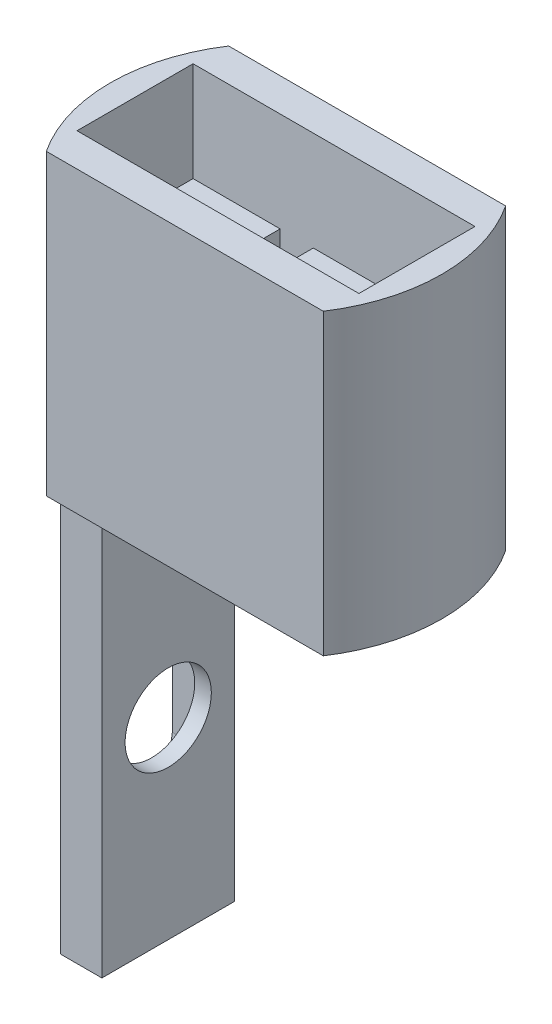
from build123d import *

# Parameters (mm, degrees)
SKETCH3_R           = 10
BOSS_EXTRUDE1_DEPTH = 18
SKETCH4_W           = 2.5
SKETCH4_H           = 8
BOSS_EXTRUDE2_DEPTH = 25
CUT_EXTRUDE1_REACH  = 33.579
SKETCH5_R           = 2.6
SKETCH7_W           = 17
SKETCH7_H           = 7
CUT_EXTRUDE3_DEPTH  = 6
SKETCH8_W           = 2
SKETCH8_H           = 7
CUT_EXTRUDE4_DEPTH  = 4
SKETCH11_W          = 5.5
SKETCH11_H          = 21
CUT_EXTRUDE7_DEPTH  = 1.5
CUT_EXTRUDE5_DEPTH  = 43
BOSS_EXTRUDE3_DEPTH = 1.5


with BuildPart() as part:
    # Sketch3 → Boss-Extrude1 (new body)
    with BuildSketch(Plane(origin=(0, 0, 0), x_dir=(1, 0, 0), z_dir=(0, 1, 0))):
        with Locations(Location((0, 0, 0), (0, 0, 270))):
            Circle(SKETCH3_R)
    extrude(amount=BOSS_EXTRUDE1_DEPTH)

    # Sketch4 → Boss-Extrude2 (add)
    with BuildSketch(Plane(origin=(0, 0, 0), x_dir=(-1, 0, 0), z_dir=(0, -1, 0))):
        with Locations((7.75, 0)):
            Rectangle(SKETCH4_W, SKETCH4_H)
    extrude(amount=BOSS_EXTRUDE2_DEPTH)

    # Sketch5 → Cut-Extrude1 (cut, up to next)
    with BuildSketch(Plane(origin=(-6.5, 0, 0), x_dir=(0, 0, -1), z_dir=(1, 0, 0)), mode=Mode.PRIVATE) as cut_extrude1_sk1:
        with Locations((0, -13.4)):
            Circle(SKETCH5_R)
    cut_extrude1_tool1 = extrude(cut_extrude1_sk1.sketch, amount=-CUT_EXTRUDE1_REACH, mode=Mode.PRIVATE) & part.part
    add(cut_extrude1_tool1.solids().sort_by_distance((-6.5, -13.4, 0))[0], mode=Mode.SUBTRACT)

    # Sketch7 → Cut-Extrude3 (cut)
    with BuildSketch(Plane(origin=(0, 18, 0), x_dir=(1, 0, 0), z_dir=(0, 1, 0))):
        Rectangle(SKETCH7_W, SKETCH7_H)
    extrude(amount=-CUT_EXTRUDE3_DEPTH, mode=Mode.SUBTRACT)

    # Sketch8 → Cut-Extrude4 (cut)
    with BuildSketch(Plane(origin=(0, 12, 0), x_dir=(1, 0, 0), z_dir=(0, 1, 0))):
        with Locations((-2.25, 0)):
            Rectangle(SKETCH8_W, SKETCH8_H)
    extrude(amount=-CUT_EXTRUDE4_DEPTH, mode=Mode.SUBTRACT)

    # Sketch11 → Cut-Extrude7 (cut)
    with BuildSketch(Plane.ZY.offset(9)):
        with Locations((0, -13.4)):
            Rectangle(SKETCH11_W, SKETCH11_H)
    extrude(amount=-CUT_EXTRUDE7_DEPTH, mode=Mode.SUBTRACT)

    # Sketch9 → Cut-Extrude5 (cut)
    with BuildSketch(Plane.XZ):
        with BuildLine():
            Line((8.351646544, -5.5), (-8.351646544, -5.5))
            ThreePointArc((-8.351646544, -5.5), (0, -10), (8.351646544, -5.5))
        make_face()
        with BuildLine():
            Line((8.351646544, 5.5), (-8.351646544, 5.5))
            ThreePointArc((-8.351646544, 5.5), (0, 10), (8.351646544, 5.5))
        make_face()
    extrude(amount=-CUT_EXTRUDE5_DEPTH, mode=Mode.SUBTRACT)

    # Sketch10 → Boss-Extrude3 (add)
    with BuildSketch(Plane.ZY.offset(9)):
        Polygon((-2.749970665, -23.9), (-2.749970665, -16.8), (-1.499970665, -23.9), align=None)
        Polygon((1.499970665, -23.9), (2.749970665, -23.9), (2.749970665, -16.8), align=None)
        Polygon((2.749970665, -2.9), (2.749970665, -10), (1.499970665, -2.9), align=None)
        Polygon((-1.499970665, -2.9), (-2.749970665, -2.9), (-2.749970665, -10), align=None)
    extrude(amount=-BOSS_EXTRUDE3_DEPTH)


solid = part.part
